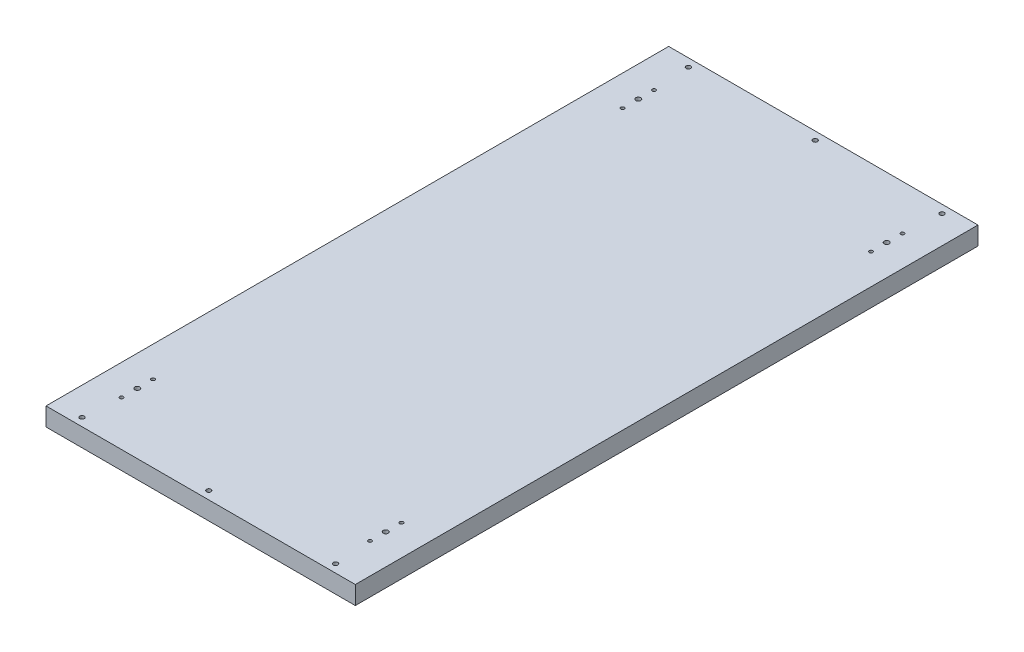
from build123d import *

# Parameters (mm, degrees)
SKETCH1_W                                         = 305
SKETCH1_H                                         = 614
BOSS_EXTRUDE1_DEPTH                               = 9
CSK_FOR_8_FLAT_HEAD_MACHINE_SCREW_100_D           = 4.4958
CSK_FOR_8_FLAT_HEAD_MACHINE_SCREW_100_CSINK_D     = 8.4328
CSK_FOR_8_FLAT_HEAD_MACHINE_SCREW_100_CSINK_ANGLE = 100
F_8_36_TAPPED_HOLE1_D                             = 3.4544
F_8_CLEARANCE_HOLE1_D                             = 4.9149
MIRROR2_AT_THE_SECOND_PLANE_COPY_1_D              = 3.4544
MIRROR2_AT_THE_SECOND_PLANE_COPY_2_D              = 4.9149


with BuildPart() as part:
    # Sketch1 → Boss-Extrude1 (new, symmetric)
    with BuildSketch(Plane(origin=(0, 0, 0), x_dir=(1, 0, 0), z_dir=(0, 1, 0))):
        Rectangle(SKETCH1_W, SKETCH1_H)
    extrude(amount=BOSS_EXTRUDE1_DEPTH, both=True)

    # CSK for #8 Flat Head Machine Screw (100)1 (through all)
    with Locations(Plane(origin=(-75, -9, 0), x_dir=(0, 0, -1), z_dir=(0, -1, 0))):
        with Locations((-299, 75), (-299, -50), (-299, 200)):
            csk_for_8_flat_head_machine_screw_100 = CounterSinkHole(CSK_FOR_8_FLAT_HEAD_MACHINE_SCREW_100_D / 2, CSK_FOR_8_FLAT_HEAD_MACHINE_SCREW_100_CSINK_D / 2, counter_sink_angle=CSK_FOR_8_FLAT_HEAD_MACHINE_SCREW_100_CSINK_ANGLE)

    # Mirror1: CSK for #8 Flat Head Machine Screw (100)1 across plane
    add(csk_for_8_flat_head_machine_screw_100.mirror(Plane.XY), mode=Mode.SUBTRACT)

    # #8-36 Tapped Hole1 (through all)
    with Locations(Plane(origin=(0, -9, 0), x_dir=(-1, 0, 0), z_dir=(0, -1, 0))):
        with Locations((122.5, -262.5), (122.5, -231.5)):
            f_8_36_tapped_hole1 = Hole(F_8_36_TAPPED_HOLE1_D / 2)

    # #8 Clearance Hole1 (through all)
    with Locations(Plane(origin=(0, -9, 0), x_dir=(-1, 0, 0), z_dir=(0, -1, 0))):
        with Locations((122.5, -247)):
            f_8_clearance_hole1 = Hole(F_8_CLEARANCE_HOLE1_D / 2)

    # Mirror2: #8-36 Tapped Hole1, #8 Clearance Hole1 across plane
    add(f_8_36_tapped_hole1.mirror(Plane.XY), mode=Mode.SUBTRACT)
    add(f_8_clearance_hole1.mirror(Plane.XY), mode=Mode.SUBTRACT)

    # Mirror2 at the second plane: #8-36 Tapped Hole1, #8 Clearance Hole1 across plane
    add(f_8_36_tapped_hole1.mirror(Plane(origin=(0, 0, 0), x_dir=(0, 0, 1), z_dir=(1, 0, 0))), mode=Mode.SUBTRACT)
    add(f_8_clearance_hole1.mirror(Plane(origin=(0, 0, 0), x_dir=(0, 0, 1), z_dir=(1, 0, 0))), mode=Mode.SUBTRACT)

    # Mirror2 at the second plane copy 1 (through all)
    with Locations(Plane.XZ.offset(9)):
        with Locations((122.5, -262.5), (122.5, -231.5)):
            Hole(MIRROR2_AT_THE_SECOND_PLANE_COPY_1_D / 2)

    # Mirror2 at the second plane copy 2 (through all)
    with Locations(Plane.XZ.offset(9)):
        with Locations((122.5, -247)):
            Hole(MIRROR2_AT_THE_SECOND_PLANE_COPY_2_D / 2)


solid = part.part
